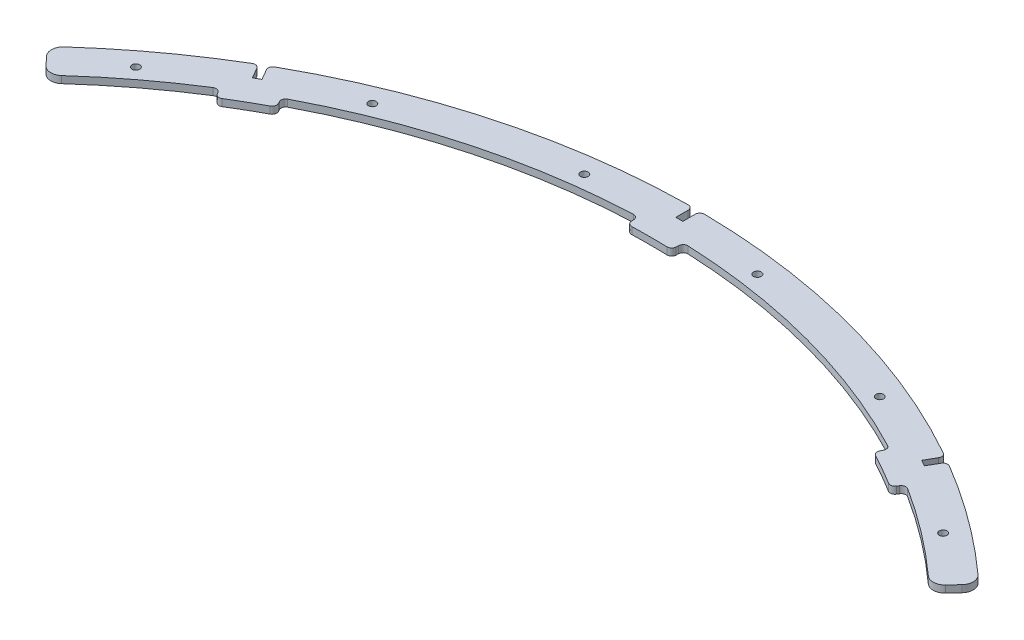
from build123d import *

# Parameters (mm, degrees)
BOSS_EXTRUDE1_DEPTH = 3
FILLET1_R           = 2
FILLET2_R           = 2
FILLET3_R           = 2
BOSS_EXTRUDE2_START = -3
BOSS_EXTRUDE2_DEPTH = 3
FILLET4_R           = 2
SKETCH3_R           = 1.65
CUT_EXTRUDE1_DEPTH  = 10


with BuildPart() as part:
    # Sketch1 → Boss-Extrude1 (new body)
    with BuildSketch(Plane(origin=(0, 0, 0), x_dir=(1, 0, 0), z_dir=(0, 1, 0))):
        with BuildLine():
            Line((-147.047108419, 251.693062887), (-143.399038106, 245.374419756))
            Line((-143.399038106, 245.374419756), (-140.800961894, 246.874419756))
            Line((-140.800961894, 246.874419756), (-144.449032207, 253.193062887))
            ThreePointArc((-144.449032207, 253.193062887), (-75.445751647, 281.567378363), (-1.5, 291.496140626))
            Line((-1.5, 291.496140626), (-1.5, 284.2))
            Line((-1.5, 284.2), (1.5, 284.2))
            Line((1.5, 284.2), (1.5, 291.496140626))
            ThreePointArc((1.5, 291.496140626), (75.445751647, 281.567378363), (144.449032207, 253.193062887))
            Line((144.449032207, 253.193062887), (140.800961894, 246.874419756))
            Line((140.800961894, 246.874419756), (143.399038106, 245.374419756))
            Line((143.399038106, 245.374419756), (147.047108419, 251.693062887))
            ThreePointArc((147.047108419, 251.693062887), (150.775979508, 249.477161286), (154.471465524, 247.20602003))
            Line((154.471465524, 247.20602003), (143.873080239, 230.245058106))
            ThreePointArc((143.873080239, 230.245058106), (135.75, 235.125897127), (127.461529296, 239.720271461))
            Line((127.461529296, 239.720271461), (129.80888711, 244.135009425))
            ThreePointArc((129.80888711, 244.135009425), (71.563465971, 267.078490969), (9.649710838, 276.331563671))
            Line((9.649710838, 276.331563671), (9.475213355, 271.334609536))
            ThreePointArc((9.475213355, 271.334609536), (0, 271.5), (-9.475213355, 271.334609536))
            Line((-9.475213355, 271.334609536), (-9.649710838, 276.331563671))
            ThreePointArc((-9.649710838, 276.331563671), (-71.563465971, 267.078490969), (-129.80888711, 244.135009425))
            Line((-129.80888711, 244.135009425), (-127.461529296, 239.720271461))
            ThreePointArc((-127.461529296, 239.720271461), (-135.75, 235.125897127), (-143.873080239, 230.245058106))
            Line((-143.873080239, 230.245058106), (-154.471465524, 247.20602003))
            ThreePointArc((-154.471465524, 247.20602003), (-150.775979508, 249.477161286), (-147.047108419, 251.693062887))
        make_face()
    extrude(amount=BOSS_EXTRUDE1_DEPTH)

    # Fillet1
    fillet1_edges = [part.edges().sort_by_distance(p)[0] for p in [
        (127.461529296, 1.5, -239.720271461),
        (129.80888711, 1.5, -244.135009425),
        (9.649710838, 1.5, -276.331563671),
        (9.475213355, 1.5, -271.334609536),
        (-9.475213355, 1.5, -271.334609536),
        (-9.649710838, 1.5, -276.331563671),
        (-129.80888711, 1.5, -244.135009425),
        (-127.461529296, 1.5, -239.720271461),
    ]]
    fillet(fillet1_edges, radius=FILLET1_R)

    # Fillet2
    fillet2_edges = [part.edges().sort_by_distance(p)[0] for p in [
        (154.471465524, 1.5, -247.20602003),
        (143.873080239, 1.5, -230.245058106),
        (-143.873080239, 1.5, -230.245058106),
        (-154.471465524, 1.5, -247.20602003),
    ]]
    fillet(fillet2_edges, radius=FILLET2_R)

    # Fillet3
    fillet3_edges = [part.edges().sort_by_distance(p)[0] for p in [
        (-147.047108419, 1.5, -251.693062887),
        (-144.449032207, 1.5, -253.193062887),
        (-1.5, 1.5, -291.496140626),
        (1.5, 1.5, -291.496140626),
        (144.449032207, 1.5, -253.193062887),
        (147.047108419, 1.5, -251.693062887),
    ]]
    fillet(fillet3_edges, radius=FILLET3_R)

    # Sketch2 → Boss-Extrude2 (add)
    with BuildSketch(Plane(origin=(0, 3, 0), x_dir=(1, 0, 0), z_dir=(0, 1, 0)).offset(BOSS_EXTRUDE2_START)):
        with BuildLine():
            Line((-152.759965651, 248.267281159), (-146.52267656, 234.485298587))
            ThreePointArc((-146.52267656, 234.485298587), (-166.367665138, 220.84847746), (-184.950980973, 205.536820636))
            ThreePointArc((-184.950980973, 205.536820636), (-188.514353616, 204.258373219), (-191.95225185, 205.843588702))
            Line((-191.95225185, 205.843588702), (-195.362772292, 209.500924109))
            ThreePointArc((-195.362772292, 209.500924109), (-196.701244935, 213.129011848), (-195.0516583, 216.6266387))
            ThreePointArc((-195.0516583, 216.6266387), (-174.623921622, 233.406803666), (-152.759965651, 248.267281159))
        make_face()
        with BuildLine():
            Line((191.95225185, 205.843588702), (195.362772292, 209.500924109))
            ThreePointArc((195.362772292, 209.500924109), (196.701244935, 213.129011848), (195.0516583, 216.6266387))
            ThreePointArc((195.0516583, 216.6266387), (174.623921622, 233.406803666), (152.759965651, 248.267281159))
            Line((152.759965651, 248.267281159), (146.52267656, 234.485298587))
            ThreePointArc((146.52267656, 234.485298587), (166.367665138, 220.84847746), (184.950980973, 205.536820636))
            ThreePointArc((184.950980973, 205.536820636), (188.514353616, 204.258373219), (191.95225185, 205.843588702))
        make_face()
    extrude(amount=BOSS_EXTRUDE2_DEPTH)

    # Fillet4
    fillet4_edges = [part.edges().sort_by_distance(p)[0] for p in [
        (-146.52267656, 1.5, -234.485298587),
        (146.52267656, 1.5, -234.485298587),
    ]]
    fillet(fillet4_edges, radius=FILLET4_R)

    # Sketch3 → Cut-Extrude1 (cut)
    with BuildSketch(Plane(origin=(0, 3, 0), x_dir=(1, 0, 0), z_dir=(0, 1, 0))):
        with Locations(Location((-36.938912398, 280.578895769, 0), (0, 0, 270))):
            Circle(SKETCH3_R)
        with Locations(Location((36.938912398, 280.578895769, 0), (0, 0, 270))):
            Circle(SKETCH3_R)
        with Locations(Location((108.299411359, 261.457907701, 0), (0, 0, 270))):
            Circle(SKETCH3_R)
        with Locations(Location((-108.299411359, 261.457907701, 0), (0, 0, 270))):
            Circle(SKETCH3_R)
        with Locations(Location((172.279484409, 224.518995302, 0), (0, 0, 270))):
            Circle(SKETCH3_R)
        with Locations(Location((-172.279484409, 224.518995302, 0), (0, 0, 270))):
            Circle(SKETCH3_R)
    extrude(amount=-CUT_EXTRUDE1_DEPTH, mode=Mode.SUBTRACT)


solid = part.part
